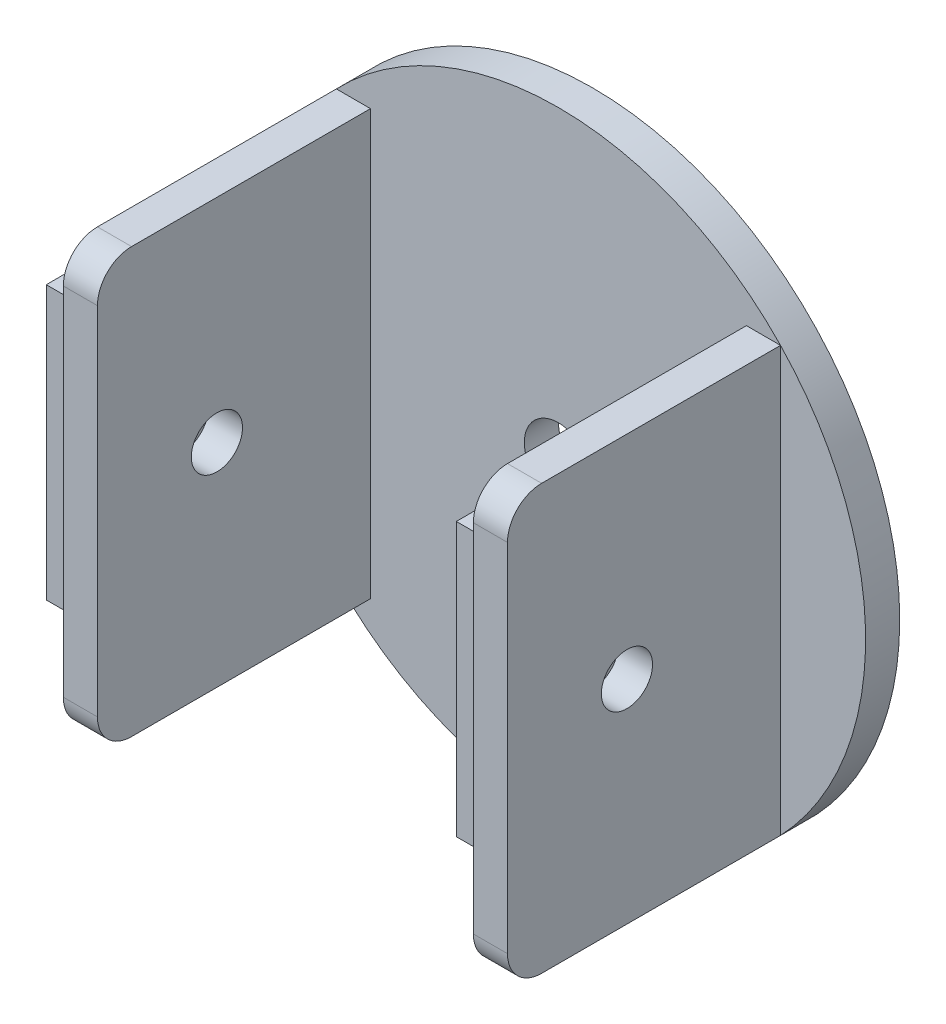
from build123d import *

# Parameters (mm, degrees)
SKETCH1_R           = 90
BOSS_EXTRUDE1_DEPTH = 10
SKETCH2_W           = 10
SKETCH2_H           = 124.350526514
BOSS_EXTRUDE2_DEPTH = 80
FILLET1_R           = 10
SKETCH3_R           = 7.5
CUT_EXTRUDE1_DEPTH  = 201.616596644
SKETCH4_R           = 10
CUT_EXTRUDE2_DEPTH  = 30
BOSS_EXTRUDE5_DEPTH = 15
BOSS_EXTRUDE6_DEPTH = 15


with BuildPart() as part:
    # Sketch1 → Boss-Extrude1 (new body)
    with BuildSketch(Plane.XY):
        Circle(SKETCH1_R)
    extrude(amount=BOSS_EXTRUDE1_DEPTH)

    # Sketch2 → Boss-Extrude2 (add)
    with BuildSketch(Plane.XY.offset(10)):
        with Locations((-60.071012279, 0)):
            Rectangle(SKETCH2_W, SKETCH2_H)
        with Locations((60.071012279, 0)):
            Rectangle(SKETCH2_W, SKETCH2_H)
    extrude(amount=BOSS_EXTRUDE2_DEPTH)

    # Fillet1
    fillet1_edges = [part.edges().sort_by_distance(p)[0] for p in [
        (60.071012279, 62.175263257, 90),
        (60.071012279, -62.175263257, 90),
        (-60.071012279, 62.175263257, 90),
        (-60.071012279, -62.175263257, 90),
    ]]
    fillet(fillet1_edges, radius=FILLET1_R)

    # Sketch3 → Cut-Extrude1 (cut, through all)
    with BuildSketch(Plane.ZY.offset(65.071012279)):
        with Locations((55, 0)):
            Circle(SKETCH3_R)
    extrude(amount=-CUT_EXTRUDE1_DEPTH, mode=Mode.SUBTRACT)

    # Sketch4 → Cut-Extrude2 (cut)
    with BuildSketch(Plane.XY.offset(10)):
        Circle(SKETCH4_R)
    extrude(amount=-CUT_EXTRUDE2_DEPTH, mode=Mode.SUBTRACT)

    # Sketch7 → Boss-Extrude5 (add)
    with BuildSketch(Plane.ZY.offset(65.071012279)):
        Polygon((30, 40), (30, -40), (42.954861641, -40), (42.954861641, -41.5), (67.045138359, -41.5), (67.045138359, -40), (80, -40), (80, 40), (67.045138359, 40), (67.045138359, 41.5), (42.954861641, 41.5), (42.954861641, 40), align=None)
    extrude(amount=BOSS_EXTRUDE5_DEPTH)

    # Sketch8 → Boss-Extrude6 (add)
    with BuildSketch(Plane.ZY.offset(-55.071012279)):
        Polygon((30, 40), (30, -40), (42.954861641, -40), (42.954861641, -41.5), (67.045138359, -41.5), (67.045138359, -40), (80, -40), (80, 40), (66.344670443, 40), (66.344670443, 41.5), (43.655329557, 41.5), (43.655329557, 40), align=None)
    extrude(amount=BOSS_EXTRUDE6_DEPTH)


solid = part.part
